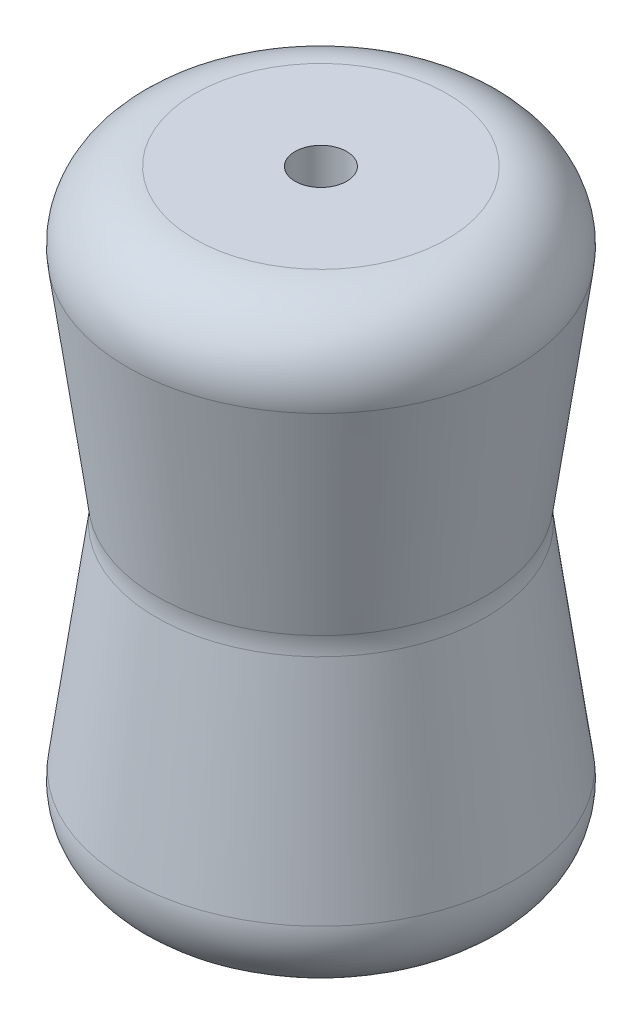
from build123d import *

# Parameters (mm, degrees)
SKETCH_3_R          = 1.9
CUT_EXTRUDE_1_DEPTH = 60
FILLET_1_R          = 5


with BuildPart() as part:
    # 草图2 → 旋转1 (revolve)
    with BuildSketch(Plane.XY, mode=Mode.PRIVATE) as revolve_1_sk:
        Polygon((0, 0), (0, 44), (-15, 44), (-12, 22), (-15, 0), align=None)
    revolve(revolve_1_sk.sketch.rotate(Axis((0, 0, 0), (0, 1, 0)), 180), axis=Axis((0, 0, 0), (0, 1, 0)))

    # 草图3 → 切除-拉伸1 (cut)
    with BuildSketch(Plane.XZ):
        with Locations(Location((0, 0, 0), (0, 0, 270))):
            Circle(SKETCH_3_R)
    extrude(amount=-CUT_EXTRUDE_1_DEPTH, mode=Mode.SUBTRACT)

    # 圆角1
    fillet_1_edges = [part.edges().sort_by_distance(p)[0] for p in [
        (-15, 44, 0),
        (-15, 0, 0),
        (-12, 22, 0),
    ]]
    fillet(fillet_1_edges, radius=FILLET_1_R)


solid = part.part
